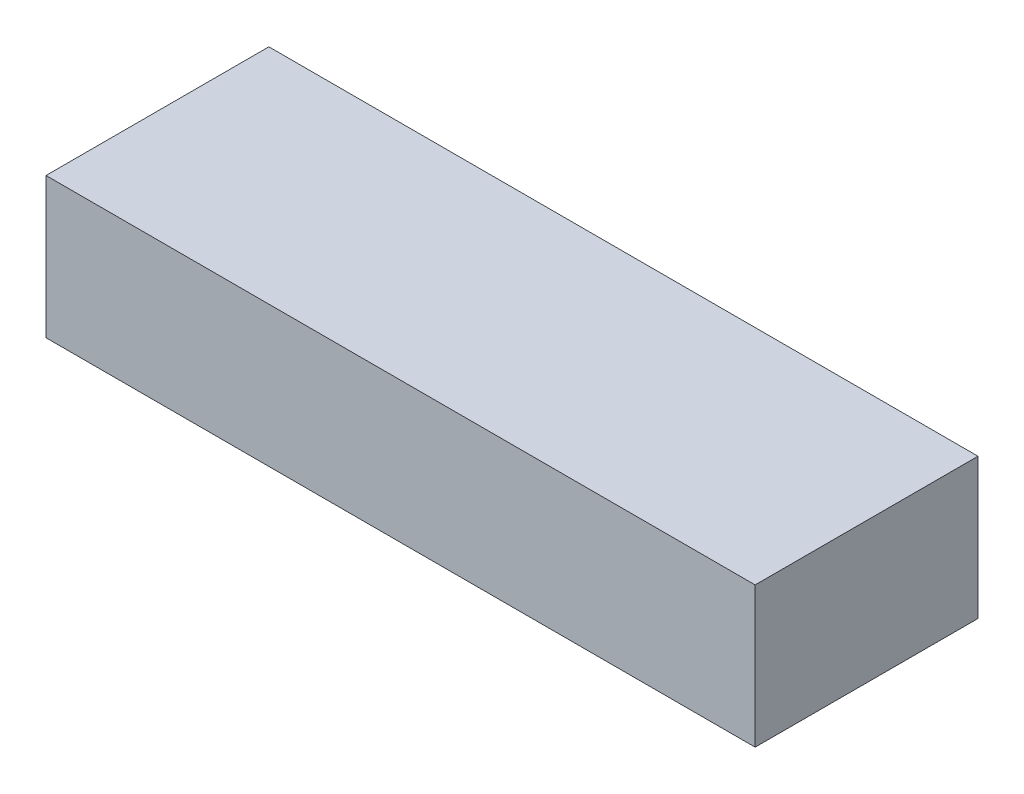
from build123d import *

# Parameters (mm, degrees)
SKETCH_1_W      = 140
SKETCH_1_H      = 44
EXTRUDE_1_DEPTH = 27.75


with BuildPart() as part:
    # 草圖1 → 填料-伸長1 (new body)
    with BuildSketch(Plane(origin=(0, 0, 0), x_dir=(1, 0, 0), z_dir=(0, 1, 0))):
        Rectangle(SKETCH_1_W, SKETCH_1_H)
    extrude(amount=EXTRUDE_1_DEPTH)


solid = part.part
